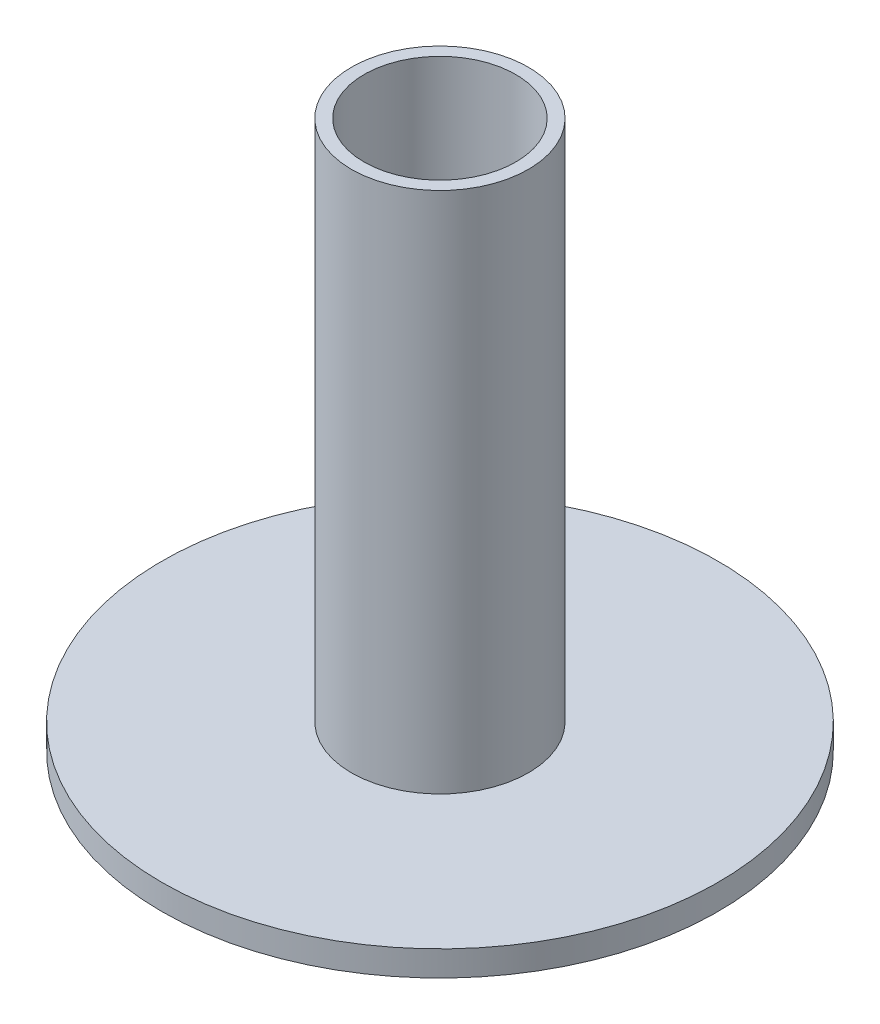
from build123d import *

# Parameters (mm, degrees)
CROQUIS1_R              = 33
SALIENTE_EXTRUIR1_DEPTH = 3
CROQUIS2_R              = 10.5
SALIENTE_EXTRUIR2_DEPTH = 62
CROQUIS5_R              = 8.75
CORTAR_EXTRUIR5_DEPTH   = 10
CROQUIS7_R              = 9
CORTAR_EXTRUIR6_DEPTH   = 35


with BuildPart() as part:
    # Croquis1 → Saliente-Extruir1 (new body)
    with BuildSketch(Plane(origin=(0, 0, 0), x_dir=(1, 0, 0), z_dir=(0, 1, 0))):
        with Locations(Location((0, 0, 0), (0, 0, 270))):
            Circle(CROQUIS1_R)
    extrude(amount=SALIENTE_EXTRUIR1_DEPTH)

    # Croquis2 → Saliente-Extruir2 (add)
    with BuildSketch(Plane(origin=(0, 3, 0), x_dir=(1, 0, 0), z_dir=(0, 1, 0))):
        with Locations(Location((0, 0, 0), (0, 0, 270))):
            Circle(CROQUIS2_R)
    extrude(amount=SALIENTE_EXTRUIR2_DEPTH)

    # Croquis5 → Cortar-Extruir5 (cut)
    with BuildSketch(Plane.XZ):
        with Locations(Location((0, 0, 0), (0, 0, 270))):
            Circle(CROQUIS5_R)
    extrude(amount=-CORTAR_EXTRUIR5_DEPTH, mode=Mode.SUBTRACT)

    # Croquis7 → Cortar-Extruir6 (cut)
    with BuildSketch(Plane(origin=(0, 65, 0), x_dir=(1, 0, 0), z_dir=(0, 1, 0))):
        with Locations(Location((0, 0, 0), (0, 0, 270))):
            Circle(CROQUIS7_R)
    extrude(amount=-CORTAR_EXTRUIR6_DEPTH, mode=Mode.SUBTRACT)


solid = part.part
